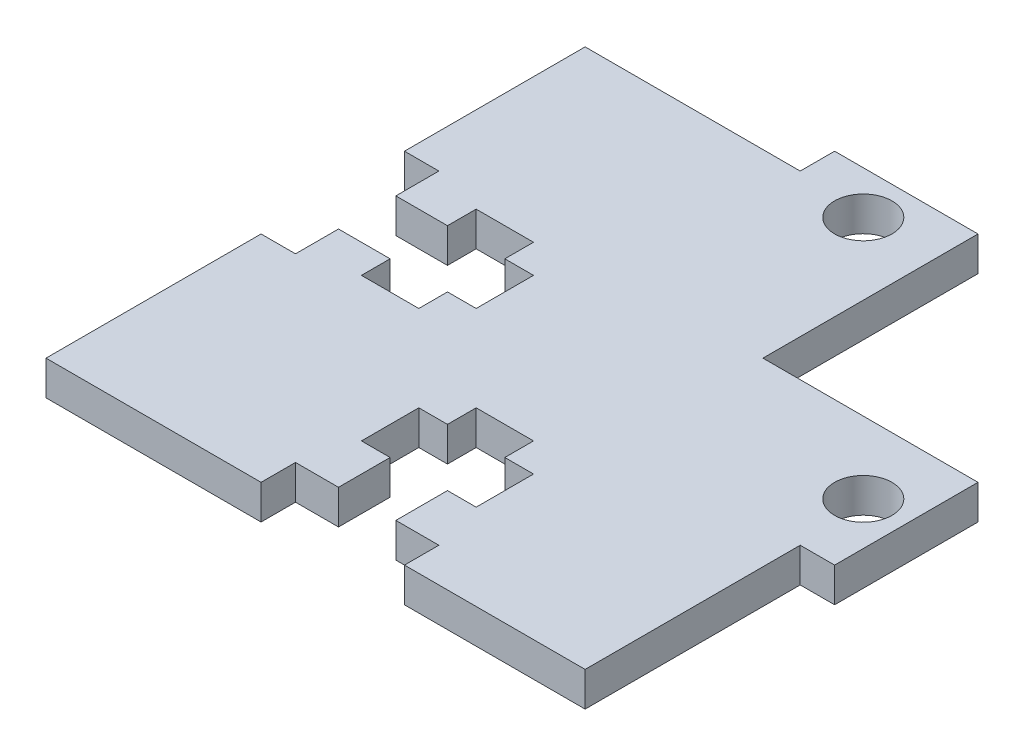
from build123d import *

# Parameters (mm, degrees)
BOSS_EXTRUDE1_DEPTH = 3.048
SKETCH2_W           = 4.572
SKETCH2_H           = 5.08
SKETCH2_W_2         = 5.08
SKETCH2_H_2         = 2.54
SKETCH2_W_3         = 2.54
SKETCH2_H_3         = 4.572
SKETCH2_R           = 2.54
CUT_EXTRUDE1_DEPTH  = 3.048
SKETCH3_W           = 16.002
SKETCH3_H           = 16.002
CUT_EXTRUDE2_DEPTH  = 3.048


with BuildPart() as part:
    # Sketch1 → Boss-Extrude1 (new body)
    with BuildSketch(Plane(origin=(0, 0, 0), x_dir=(1, 0, 0), z_dir=(0, 1, 0))):
        Polygon((0, 19.05), (0, 0), (19.05, 0), (19.05, 3.048), (31.75, 3.048), (31.75, 0), (47.752, 0), (47.752, 19.05), (50.8, 19.05), (50.8, 31.75), (47.752, 31.75), (47.752, 47.752), (31.75, 47.752), (31.75, 50.8), (19.05, 50.8), (19.05, 47.752), (0, 47.752), (0, 31.75), (3.048, 31.75), (3.048, 19.05), align=None)
    extrude(amount=BOSS_EXTRUDE1_DEPTH)

    # Sketch2 → Cut-Extrude1 (cut)
    with BuildSketch(Plane(origin=(0, 3.048, 0), x_dir=(1, 0, 0), z_dir=(0, 1, 0))):
        with Locations((5.334, 25.4)):
            Rectangle(SKETCH2_W, SKETCH2_H)
        with Locations((10.16, 25.4)):
            Rectangle(SKETCH2_W_2, SKETCH2_H)
        with Locations((10.16, 29.21)):
            Rectangle(SKETCH2_W_2, SKETCH2_H_2)
        with Locations((13.97, 25.4)):
            Rectangle(SKETCH2_W_3, SKETCH2_H)
        with Locations((10.16, 21.59)):
            Rectangle(SKETCH2_W_2, SKETCH2_H_2)
        with Locations((25.4, 13.97)):
            Rectangle(SKETCH2_W_2, SKETCH2_H_2)
        with Locations((25.4, 10.16)):
            Rectangle(SKETCH2_W_2, SKETCH2_H)
        with Locations((29.21, 10.16)):
            Rectangle(SKETCH2_W_3, SKETCH2_H)
        with Locations((21.59, 10.16)):
            Rectangle(SKETCH2_W_3, SKETCH2_H)
        with Locations((25.4, 5.334)):
            Rectangle(SKETCH2_W_2, SKETCH2_H_3)
        with Locations(Location((46.99, 25.4, 0), (0, 0, 270))):
            Circle(SKETCH2_R)
        with Locations(Location((25.4, 46.99, 0), (0, 0, 270))):
            Circle(SKETCH2_R)
    extrude(amount=-CUT_EXTRUDE1_DEPTH, mode=Mode.SUBTRACT)

    # Sketch3 → Cut-Extrude2 (cut)
    with BuildSketch(Plane(origin=(0, 3.048, 0), x_dir=(1, 0, 0), z_dir=(0, 1, 0))):
        with Locations((39.751, 39.751)):
            Rectangle(SKETCH3_W, SKETCH3_H)
    extrude(amount=-CUT_EXTRUDE2_DEPTH, mode=Mode.SUBTRACT)


solid = part.part
